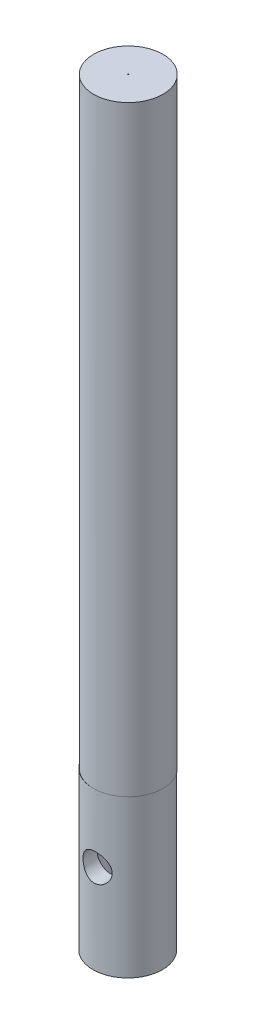
from build123d import *

# Parameters (mm, degrees)
SKETCH1_R               = 3.75
BOSS_EXTRUDE1_DEPTH     = 17
SKETCH2_R               = 3.75
SKETCH2_R_2             = 0.058819456
BOSS_EXTRUDE2_DEPTH     = 65
CUT_EXTRUDE1_REACH      = 84.174
CUT_EXTRUDE1_END_RADIUS = 3.75
SKETCH3_R               = 1.5


with BuildPart() as part:
    # Sketch1 → Boss-Extrude1 (new body)
    with BuildSketch(Plane(origin=(0, 0, 0), x_dir=(1, 0, 0), z_dir=(0, 1, 0))):
        with Locations(Location((0, 0, 0), (0, 0, 270))):
            Circle(SKETCH1_R)
        with BuildLine():
            Line((1.5, -2), (-1.5, -2))
            ThreePointArc((-1.5, -2), (0, 2.5), (1.5, -2))
        make_face(mode=Mode.SUBTRACT)
    extrude(amount=BOSS_EXTRUDE1_DEPTH)

    # Sketch2 → Boss-Extrude2 (add)
    with BuildSketch(Plane(origin=(0, 17, 0), x_dir=(1, 0, 0), z_dir=(0, 1, 0))):
        with Locations(Location((0.058819456, 0, 0), (0, 0, 90.449352147))):
            Circle(SKETCH2_R)
        with Locations(Location((0.058819456, 0, 0), (0, 0, 270))):
            Circle(SKETCH2_R_2, mode=Mode.SUBTRACT)
    extrude(amount=BOSS_EXTRUDE2_DEPTH)

    # Cut-Extrude1: up to this cylinder (the profile starts inside it)
    cut_extrude1_end = Plane(origin=(0, 9.674653, 0), z_dir=(0, -1, 0)) * Cylinder(CUT_EXTRUDE1_END_RADIUS, 176.848, mode=Mode.PRIVATE)
    # Sketch3 → Cut-Extrude1 (cut, up to the surface)
    with BuildSketch(Plane.XY, mode=Mode.PRIVATE) as cut_extrude1_sk1:
        with Locations(Location((0.177976735, 9.674652852, 0), (0, 0, 180))):
            Circle(SKETCH3_R)
    cut_extrude1_tool1 = extrude(cut_extrude1_sk1.sketch, amount=CUT_EXTRUDE1_REACH, mode=Mode.PRIVATE) & cut_extrude1_end
    add(cut_extrude1_tool1.solids().sort_by_distance((0.177977, 9.674653, 0))[0], mode=Mode.SUBTRACT)


solid = part.part
